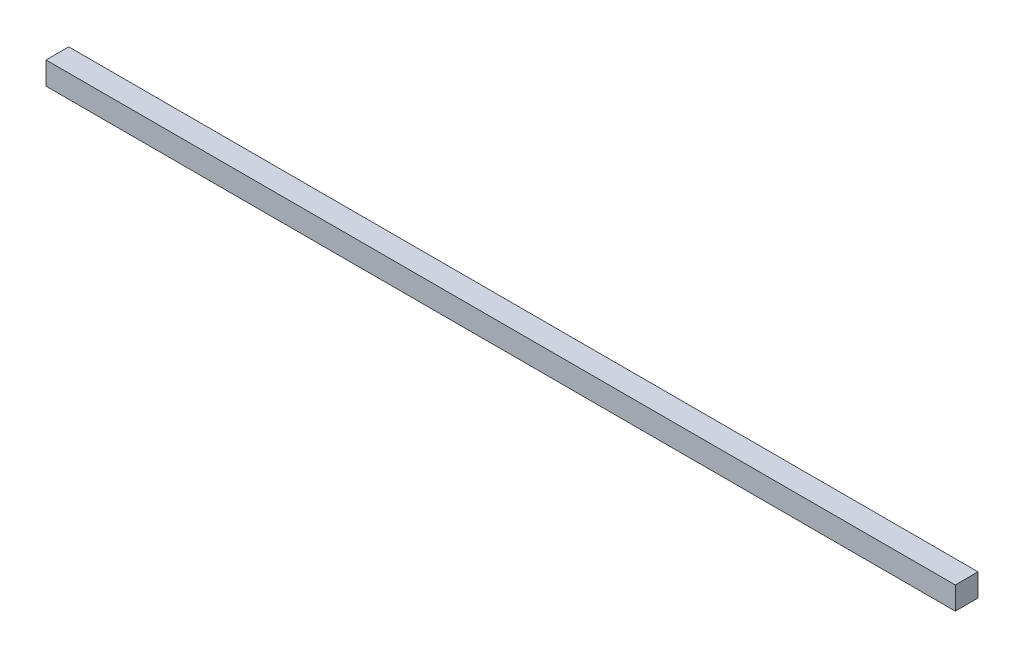
from build123d import *

# Parameters (mm, degrees)
SKETCH1_W           = 15
SKETCH1_H           = 15
BOSS_EXTRUDE1_DEPTH = 600


with BuildPart() as part:
    # Sketch1 → Boss-Extrude1 (new body)
    with BuildSketch(Plane(origin=(0, 0, 0), x_dir=(0, 0, -1), z_dir=(1, 0, 0))):
        Rectangle(SKETCH1_W, SKETCH1_H)
    extrude(amount=BOSS_EXTRUDE1_DEPTH)


solid = part.part
